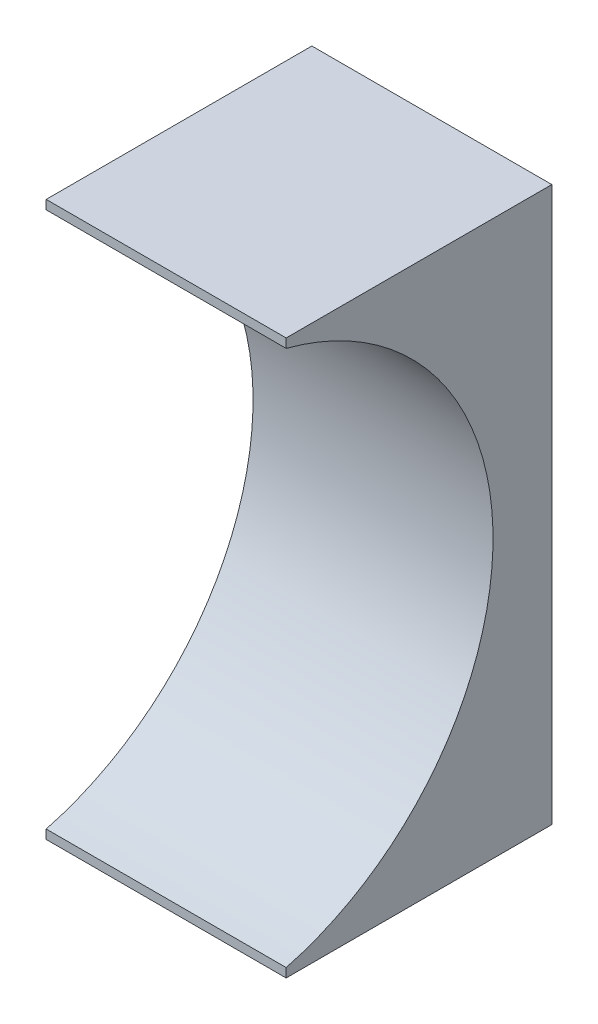
from build123d import *

# Parameters (mm, degrees)
SALIENTE_EXTRUIR2_DEPTH = 20
CROQUIS5_OUTSIDE_W      = 41.522
CROQUIS5_OUTSIDE_H      = 59.722
CROQUIS5_OUTSIDE_W_2    = 22.143022039
CROQUIS5_OUTSIDE_H_2    = 46.2
CORTAR_EXTRUIR1_DEPTH   = 42.444058682


with BuildPart() as part:
    # Croquis4 → Saliente-Extruir2 (new body)
    with BuildSketch(Plane(origin=(0, 0, 0), x_dir=(0, 0, -1), z_dir=(1, 0, 0))):
        with BuildLine():
            Line((0, 23.1), (28, 23.1))
            Line((28, 23.1), (28, -23.1))
            Line((28, -23.1), (0, -23.1))
            ThreePointArc((0, -23.1), (23.1, 0), (0, 23.1))
        make_face()
    extrude(amount=SALIENTE_EXTRUIR2_DEPTH)

    # Croquis5 outside → Cortar-Extruir1 (cut, through all)
    with BuildSketch(Plane(origin=(20, 0, 0), x_dir=(0, 0, -1), z_dir=(1, 0, 0))):
        with Locations((14, 0)):
            Rectangle(CROQUIS5_OUTSIDE_W, CROQUIS5_OUTSIDE_H)
        with Locations((16.92848898, 0)):
            Rectangle(CROQUIS5_OUTSIDE_W_2, CROQUIS5_OUTSIDE_H_2, mode=Mode.SUBTRACT)
    extrude(amount=-CORTAR_EXTRUIR1_DEPTH, mode=Mode.SUBTRACT)


solid = part.part
